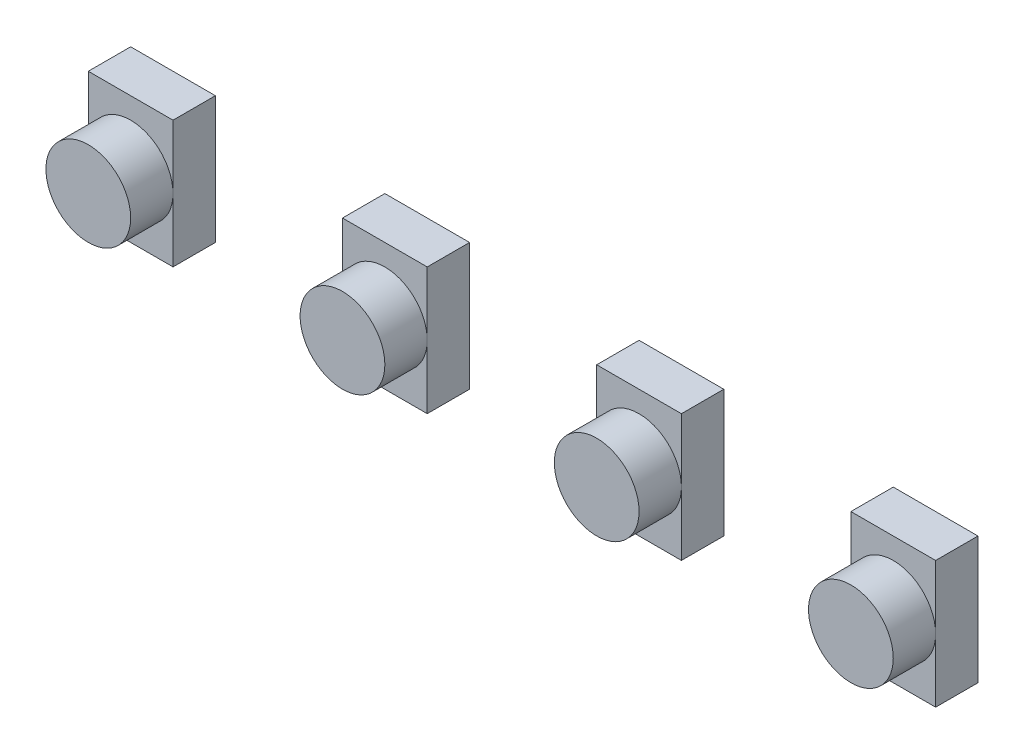
from build123d import *

# Parameters (mm, degrees)
SKETCH_1_W        = 10
SKETCH_1_H        = 15
EXTRUDE_1_DEPTH   = 5
EXTRUDE_1_2_DEPTH = 5
EXTRUDE_1_3_DEPTH = 5
EXTRUDE_1_4_DEPTH = 5
SKETCH_3_R        = 5
EXTRUDE_2_DEPTH   = 5


with BuildPart() as part:
    # 草图1 → 凸台-拉伸1 (new body)
    with BuildSketch(Plane.XY):
        with Locations((116.467654294, 31.785358307)):
            Rectangle(SKETCH_1_W, SKETCH_1_H)
    extrude(amount=EXTRUDE_1_DEPTH)



with BuildPart() as body_2:
    # 草图1 → Extrude 1 2 (new body)
    with BuildSketch(Plane.XY):
        with Locations((86.467654294, 31.785358307)):
            Rectangle(SKETCH_1_W, SKETCH_1_H)
    extrude(amount=EXTRUDE_1_2_DEPTH)


with BuildPart() as body_3:
    # 草图1 → Extrude 1 3 (new body)
    with BuildSketch(Plane.XY):
        with Locations((56.467654294, 31.785358307)):
            Rectangle(SKETCH_1_W, SKETCH_1_H)
    extrude(amount=EXTRUDE_1_3_DEPTH)


with BuildPart() as body_4:
    # 草图1 → Extrude 1 4 (new body)
    with BuildSketch(Plane.XY):
        with Locations((146.467654294, 31.785358307)):
            Rectangle(SKETCH_1_W, SKETCH_1_H)
    extrude(amount=EXTRUDE_1_4_DEPTH)


with BuildPart() as part_1:
    add(part.part)

    add(body_2.part)  # 凸台-拉伸2 merges body 2

    add(body_3.part)  # 凸台-拉伸2 merges body 3
    # 草图3 → 凸台-拉伸2 (add)
    with BuildSketch(Plane.XY.offset(5)):
        with Locations((116.467654294, 31.785358307)):
            Circle(SKETCH_3_R)
        with Locations((86.467654294, 31.785358307)):
            Circle(SKETCH_3_R)
        with Locations((56.467654294, 31.785358307)):
            Circle(SKETCH_3_R)
        with Locations((146.467654294, 31.785358307)):
            Circle(SKETCH_3_R)
    extrude(amount=EXTRUDE_2_DEPTH)


solid = Compound([body_4.part, part_1.part])
